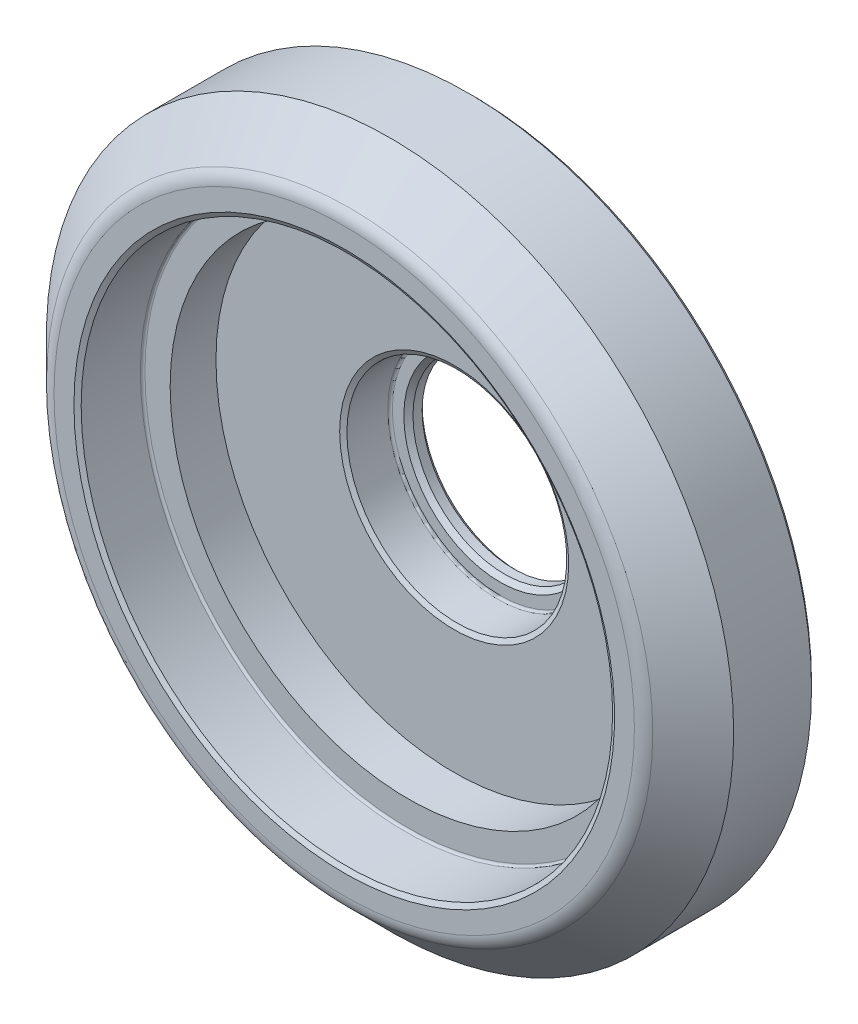
from build123d import *

# Parameters (mm, degrees)
FILLET_1_R      = 2
CHAMFER_1_SIZE  = 0.5
CHAMFER_1_SIZE2 = 0.288675135
CHAMFER_2_SIZE  = 0.5
CHAMFER_2_SIZE2 = 0.288675135
SKETCH_2_R      = 17.5
SKETCH_2_R_2    = 10
EXTRUDE_1_DEPTH = 2
CHAMFER_3_SIZE  = 0.5
CHAMFER_4_SIZE  = 0.5
FILLET_2_R      = 0.25


with BuildPart() as part:
    # ｽｹｯﾁ1 → 回転1 (revolve)
    with BuildSketch(Plane(origin=(0, 0, 0), x_dir=(0, 0, -1), z_dir=(1, 0, 0)), mode=Mode.PRIVATE) as revolve_1_sk:
        Polygon((-9, 37.5), (-14, 32.5), (-14, 29), (-7, 29), (-7, 26), (-2, 26), (-2, 12), (3, 12), (3, 17.5), (0, 17.5), (0, 37.5), align=None)
    revolve(revolve_1_sk.sketch.rotate(Axis((0, 0, 26.899509804), (0, 0, -1)), 90), axis=Axis((0, 0, 26.899509804), (0, 0, -1)))

    # ﾌｨﾚｯﾄ1
    fillet_1_edges = [part.edges().sort_by_distance(p)[0] for p in [
        (-17.5, 0, 0),
        (-32.5, 0, 14),
    ]]
    fillet(fillet_1_edges, radius=FILLET_1_R)

    # 面取り1
    chamfer_1_edges = [part.edges().sort_by_distance(p)[0] for p in [
        (-29, 0, 14),
    ]]
    chamfer_1_side = [part.faces().sort_by_distance(p)[0] for p in [
        (-30.775765517, 0, 14),
    ]]
    chamfer(chamfer_1_edges, length=CHAMFER_1_SIZE, length2=CHAMFER_1_SIZE2, reference=chamfer_1_side[0])

    # 面取り2
    chamfer_2_edges = [part.edges().sort_by_distance(p)[0] for p in [
        (-12, 0, 2),
    ]]
    chamfer_2_side = [part.faces().sort_by_distance(p)[0] for p in [
        (-25.264608948, 0, 2),
    ]]
    chamfer(chamfer_2_edges, length=CHAMFER_2_SIZE, length2=CHAMFER_2_SIZE2, reference=chamfer_2_side[0])

    # ｽｹｯﾁ2 → ﾎﾞｽ - 押し出し1 (add)
    with BuildSketch(Plane(origin=(0, 0, -3), x_dir=(-1, 0, 0), z_dir=(0, 0, -1))):
        with Locations(Location((0, 0, 0), (0, 0, 180))):
            Circle(SKETCH_2_R)
        Circle(SKETCH_2_R_2, mode=Mode.SUBTRACT)
    extrude(amount=EXTRUDE_1_DEPTH)

    # 面取り3
    chamfer_3_edges = [part.edges().sort_by_distance(p)[0] for p in [
        (10, 0, -3),
        (10, 0, -5),
    ]]
    chamfer(chamfer_3_edges, length=CHAMFER_3_SIZE)

    # 面取り4
    chamfer_4_edges = [part.edges().sort_by_distance(p)[0] for p in [
        (-37.5, 0, 0),
        (-17.5, 0, -5),
    ]]
    chamfer(chamfer_4_edges, length=CHAMFER_4_SIZE)

    # ﾌｨﾚｯﾄ2
    fillet_2_edges = [part.edges().sort_by_distance(p)[0] for p in [
        (-12, 0, -3),
        (-29, 0, 7),
    ]]
    fillet(fillet_2_edges, radius=FILLET_2_R)


solid = part.part
